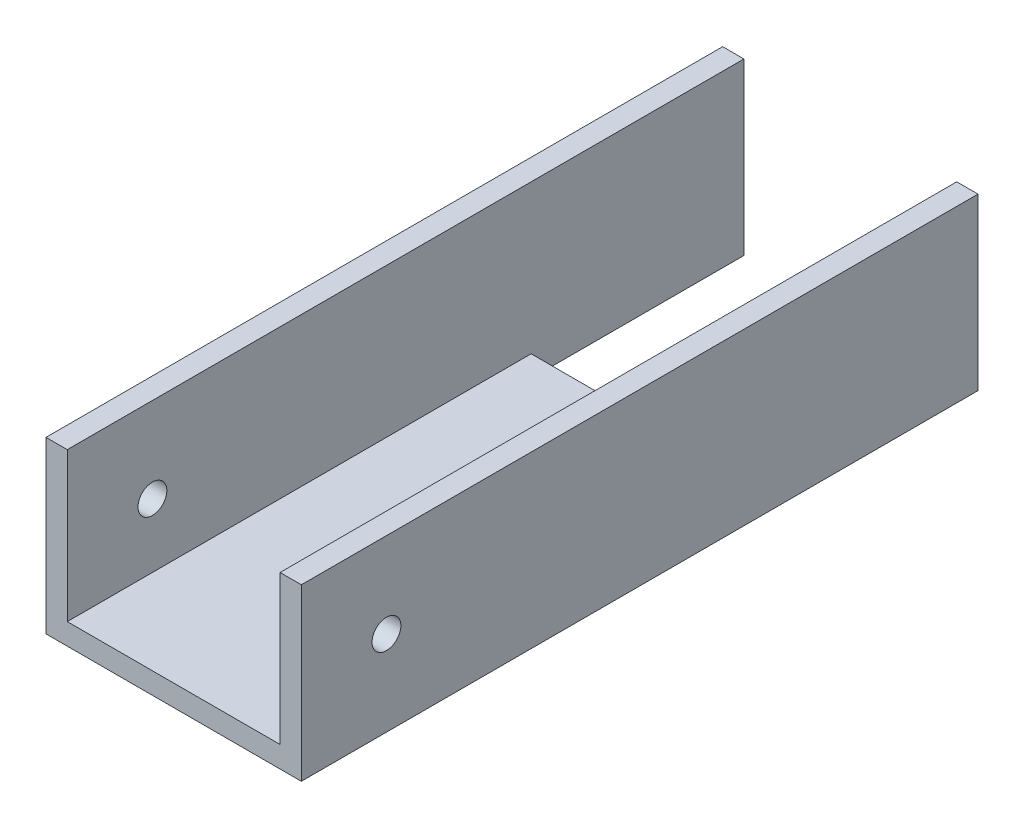
from build123d import *

# Parameters (mm, degrees)
BOSS_EXTRUDE2_DEPTH   = 609.6
CUT_EXTRUDE1_DEPTH    = 1118.235
CUT_EXTRUDE2_REACH    = 612.426
SKETCH6_W             = 31.75
SKETCH6_H             = 31.75
F_6_CLEARANCE_HOLE1_D = 4.3053


with BuildPart() as part:
    # Sketch3 → Boss-Extrude2 (new, symmetric)
    with BuildSketch(Plane.XY):
        Polygon((-19.05, 12.7), (-19.05, -12.7), (19.05, -12.7), (19.05, 12.7), (15.875, 12.7), (15.875, -9.525), (-15.875, -9.525), (-15.875, 12.7), align=None)
    extrude(amount=BOSS_EXTRUDE2_DEPTH, both=True)

    # Sketch5 → Cut-Extrude1 (cut)
    with BuildSketch(Plane.XY.offset(609.6)):
        Polygon((-19.05, 12.7), (-15.875, 12.7), (-15.875, -9.525), (15.875, -9.525), (15.875, 12.7), (19.05, 12.7), (19.05, -12.7), (-19.05, -12.7), align=None)
    extrude(amount=-CUT_EXTRUDE1_DEPTH, mode=Mode.SUBTRACT)

    # Sketch6 → Cut-Extrude2 (cut, up to next)
    with BuildSketch(Plane.XZ.offset(12.7), mode=Mode.PRIVATE) as cut_extrude2_sk1:
        with Locations((0, -593.725)):
            Rectangle(SKETCH6_W, SKETCH6_H)
    cut_extrude2_tool1 = extrude(cut_extrude2_sk1.sketch, amount=-CUT_EXTRUDE2_REACH, mode=Mode.PRIVATE) & part.part
    add(cut_extrude2_tool1.solids().sort_by_distance((0, -12.7, -593.725))[0], mode=Mode.SUBTRACT)

    # #6 Clearance Hole1 (through all)
    with Locations(Plane(origin=(19.05, 0, 0), x_dir=(0, 0, -1), z_dir=(1, 0, 0))):
        with Locations((521.335, 0)):
            Hole(F_6_CLEARANCE_HOLE1_D / 2)


solid = part.part
